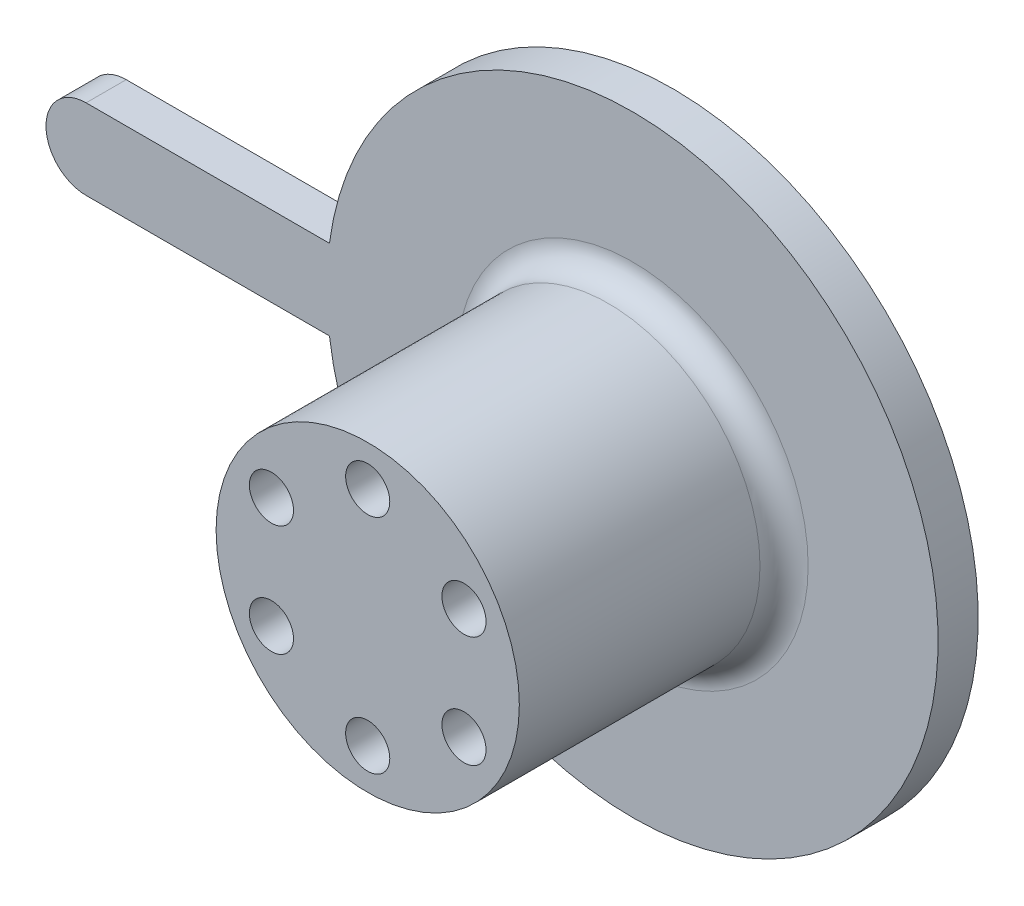
from build123d import *

# Parameters (mm, degrees)
SKETCH4_R           = 38.1
BOSS_EXTRUDE3_DEPTH = 5
SKETCH5_R           = 18.9
BOSS_EXTRUDE4_DEPTH = 33
FILLET4_R           = 3
CUT_EXTRUDE4_DEPTH  = 39.48


with BuildPart() as part:
    # Sketch4 → Boss-Extrude3 (new body)
    with BuildSketch(Plane.XY):
        Circle(SKETCH4_R)
        with BuildLine():
            Line((-68.1, 0), (-38.1, 0))
            ThreePointArc((-38.1, 0), (-38.017533534, 2.505422923), (-37.770491127, 5))
            Line((-37.770491127, 5), (-68.1, 5))
            Line((-68.1, 5), (-68.1, 0))
        make_face()
        with BuildLine():
            ThreePointArc((-37.770491127, -5), (-38.017533534, -2.505422923), (-38.1, 0))
            Line((-38.1, 0), (-68.1, 0))
            Line((-68.1, 0), (-68.1, -5))
            Line((-68.1, -5), (-37.770491127, -5))
        make_face()
        with BuildLine():
            Line((-68.1, 0), (-68.1, 5))
            ThreePointArc((-68.1, 5), (-73.1, 0), (-68.1, -5))
            Line((-68.1, -5), (-68.1, 0))
        make_face()
    extrude(amount=BOSS_EXTRUDE3_DEPTH)

    # Sketch5 → Boss-Extrude4 (add)
    with BuildSketch(Plane.XY.offset(5)):
        Circle(SKETCH5_R)
    extrude(amount=BOSS_EXTRUDE4_DEPTH)

    # Fillet4
    fillet4_edges = [part.edges().sort_by_distance(p)[0] for p in [
        (-18.9, 0, 5),
    ]]
    fillet(fillet4_edges, radius=FILLET4_R)

    # Sketch6 → Cut-Extrude4 (cut)
    with BuildSketch(Plane.XY.offset(38)):
        with BuildLine():
            Line((2.38156986, 12.481406461), (0, 13.856406461))
            Line((0, 13.856406461), (-2.38156986, 12.481406461))
            ThreePointArc((-2.38156986, 12.481406461), (0, 11.106406461), (2.38156986, 12.481406461))
        make_face()
        with BuildLine():
            Line((-2.38156986, 12.481406461), (0, 13.856406461))
            Line((0, 13.856406461), (2.38156986, 12.481406461))
            ThreePointArc((2.38156986, 12.481406461), (2.656296022, 13.144654087), (2.75, 13.856406461))
            ThreePointArc((2.75, 13.856406461), (-0.711752374, 16.512702483), (-2.38156986, 12.481406461))
        make_face()
        with BuildLine():
            ThreePointArc((14.75, 6.92820323), (12.711752374, 9.584499253), (9.61843014, 8.30320323))
            Line((9.61843014, 8.30320323), (12, 6.92820323))
            Line((12, 6.92820323), (12, 4.17820323))
            ThreePointArc((12, 4.17820323), (13.944543648, 4.983659582), (14.75, 6.92820323))
        make_face()
        with BuildLine():
            Line((12, 6.92820323), (9.61843014, 8.30320323))
            ThreePointArc((9.61843014, 8.30320323), (9.61843014, 5.55320323), (12, 4.17820323))
            Line((12, 4.17820323), (12, 6.92820323))
        make_face()
        with BuildLine():
            ThreePointArc((14.75, -6.92820323), (13.944543648, -4.983659582), (12, -4.17820323))
            Line((12, -4.17820323), (12, -6.92820323))
            Line((12, -6.92820323), (9.61843014, -8.30320323))
            ThreePointArc((9.61843014, -8.30320323), (12.711752374, -9.584499253), (14.75, -6.92820323))
        make_face()
        with BuildLine():
            Line((12, -6.92820323), (12, -4.17820323))
            ThreePointArc((12, -4.17820323), (9.61843014, -5.55320323), (9.61843014, -8.30320323))
            Line((9.61843014, -8.30320323), (12, -6.92820323))
        make_face()
        with BuildLine():
            ThreePointArc((-9.25, 6.92820323), (-9.343703978, 7.639955604), (-9.61843014, 8.30320323))
            Line((-9.61843014, 8.30320323), (-12, 6.92820323))
            Line((-12, 6.92820323), (-12, 4.17820323))
            ThreePointArc((-12, 4.17820323), (-10.055456352, 4.983659582), (-9.25, 6.92820323))
        make_face()
        with BuildLine():
            Line((-12, 6.92820323), (-9.61843014, 8.30320323))
            ThreePointArc((-9.61843014, 8.30320323), (-14.38156986, 8.30320323), (-12, 4.17820323))
            Line((-12, 4.17820323), (-12, 6.92820323))
        make_face()
        with BuildLine():
            ThreePointArc((-9.25, -6.92820323), (-10.055456352, -4.983659582), (-12, -4.17820323))
            Line((-12, -4.17820323), (-12, -6.92820323))
            Line((-12, -6.92820323), (-9.61843014, -8.30320323))
            ThreePointArc((-9.61843014, -8.30320323), (-9.343703978, -7.639955604), (-9.25, -6.92820323))
        make_face()
        with BuildLine():
            Line((-12, -6.92820323), (-12, -4.17820323))
            ThreePointArc((-12, -4.17820323), (-14.38156986, -8.30320323), (-9.61843014, -8.30320323))
            Line((-9.61843014, -8.30320323), (-12, -6.92820323))
        make_face()
        with BuildLine():
            ThreePointArc((2.38156986, -12.481406461), (0, -11.106406461), (-2.38156986, -12.481406461))
            Line((-2.38156986, -12.481406461), (0, -13.856406461))
            Line((0, -13.856406461), (2.38156986, -12.481406461))
        make_face()
        with BuildLine():
            Line((0, -13.856406461), (-2.38156986, -12.481406461))
            ThreePointArc((-2.38156986, -12.481406461), (-0.711752374, -16.512702483), (2.75, -13.856406461))
            ThreePointArc((2.75, -13.856406461), (2.656296022, -13.144654087), (2.38156986, -12.481406461))
            Line((2.38156986, -12.481406461), (0, -13.856406461))
        make_face()
    extrude(amount=-CUT_EXTRUDE4_DEPTH, mode=Mode.SUBTRACT)


solid = part.part
